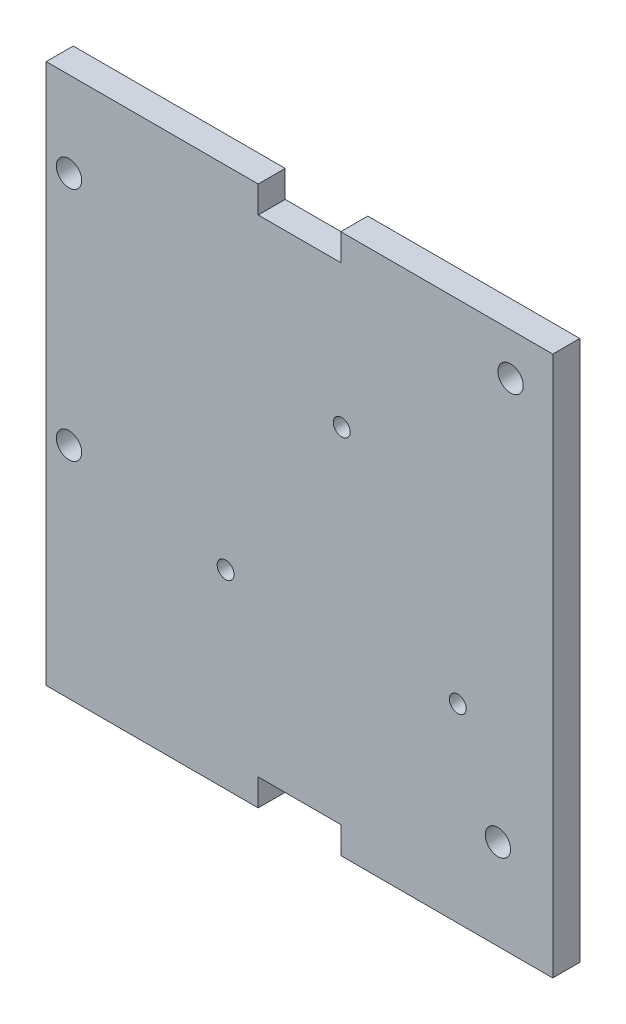
from build123d import *

# Parameters (mm, degrees)
SKETCH2_W           = 60
SKETCH2_H           = 64
TOP_DEPTH           = 3.2
SKETCH3_R           = 1.5
ARDUINO_HOLES_DEPTH = 3.2
SKETCH5_R           = 1
BATTERY_CUT_DEPTH   = 3.2
SKETCH7_W           = 9.78
SKETCH7_H           = 3.18
FRICTION_FIT_DEPTH  = 10


with BuildPart() as part:
    # Sketch2 → Top (new body)
    with BuildSketch(Plane.XY):
        with Locations((-2.549375328, 23.639166253)):
            Rectangle(SKETCH2_W, SKETCH2_H)
    extrude(amount=TOP_DEPTH)

    # Sketch3 → Arduino Holes (cut)
    with BuildSketch(Plane.XY.offset(3.2)):
        with Locations((20.950624672, 2.339166253)):
            Circle(SKETCH3_R)
        with Locations((22.450624672, 50.639166253)):
            Circle(SKETCH3_R)
        with Locations((-29.849375328, 17.639166253)):
            Circle(SKETCH3_R)
        with Locations((-29.849375328, 45.539166253)):
            Circle(SKETCH3_R)
    extrude(amount=-ARDUINO_HOLES_DEPTH, mode=Mode.SUBTRACT)

    # Sketch5 → Battery Cut (cut)
    with BuildSketch(Plane(origin=(0, 0, 0), x_dir=(-1, 0, 0), z_dir=(0, 0, -1))):
        with Locations((-2.450624672, 35.639166253)):
            Circle(SKETCH5_R)
        with Locations((-16.200624672, 14.139166253)):
            Circle(SKETCH5_R)
        with Locations((11.299375328, 14.139166253)):
            Circle(SKETCH5_R)
    extrude(amount=-BATTERY_CUT_DEPTH, mode=Mode.SUBTRACT)

    # Sketch7 → Friction Fit (cut)
    with BuildSketch(Plane(origin=(0, 0, 0), x_dir=(-1, 0, 0), z_dir=(0, 0, -1))):
        with Locations((2.549375328, 54.049166253)):
            Rectangle(SKETCH7_W, SKETCH7_H)
        with Locations((2.549375328, -6.770833747)):
            Rectangle(SKETCH7_W, SKETCH7_H)
    extrude(amount=-FRICTION_FIT_DEPTH, mode=Mode.SUBTRACT)


solid = part.part
